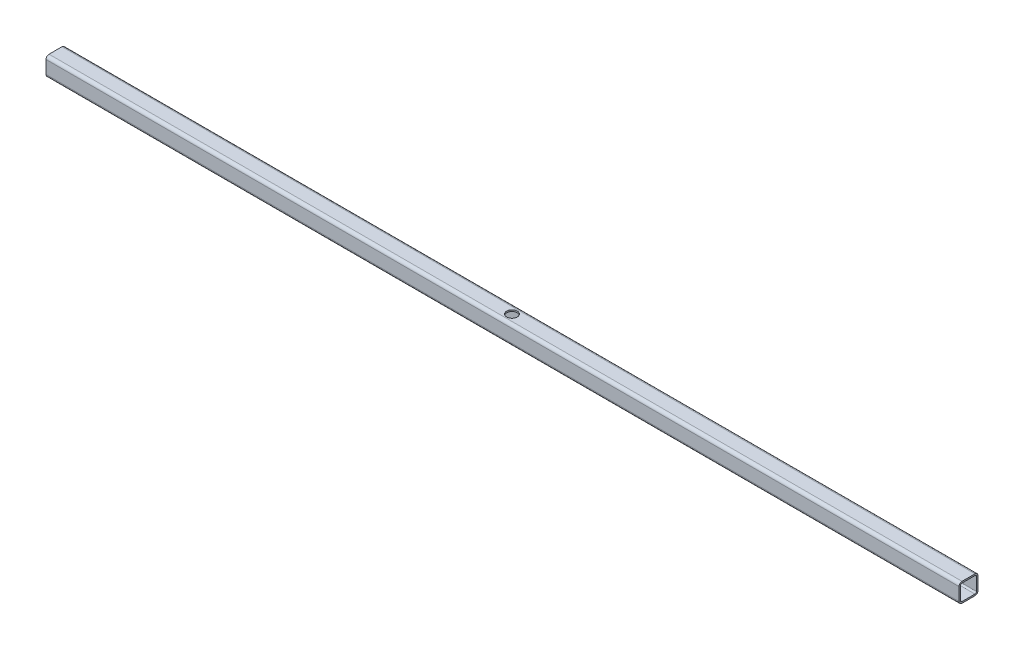
from build123d import *

# Parameters (mm, degrees)
TUBE_SQUARE_40_X_40_X_3_2_4_DEPTH = 1920
SKETCH13_R                        = 11
CUT_EXTRUDE1_DEPTH                = 1921.52076271


with BuildPart() as part:
    # Sketch12 → Tube (square) 40 X 40 X 3.2(4) (new body)
    with BuildSketch(Plane(origin=(0, 0, 0), x_dir=(0, 0, -1), z_dir=(1, 0, 0))):
        with BuildLine():
            Line((-13.6, -20), (13.6, -20))
            ThreePointArc((13.6, -20), (18.1254834, -18.1254834), (20, -13.6))
            Line((20, -13.6), (20, 13.6))
            ThreePointArc((20, 13.6), (18.1254834, 18.1254834), (13.6, 20))
            Line((13.6, 20), (-13.6, 20))
            ThreePointArc((-13.6, 20), (-18.1254834, 18.1254834), (-20, 13.6))
            Line((-20, 13.6), (-20, -13.6))
            ThreePointArc((-20, -13.6), (-18.1254834, -18.1254834), (-13.6, -20))
        make_face()
        with BuildLine():
            Line((-13.6, -16.8), (13.6, -16.8))
            ThreePointArc((13.6, -16.8), (15.8627417, -15.8627417), (16.8, -13.6))
            Line((16.8, -13.6), (16.8, 13.6))
            ThreePointArc((16.8, 13.6), (15.8627417, 15.8627417), (13.6, 16.8))
            Line((13.6, 16.8), (-13.6, 16.8))
            ThreePointArc((-13.6, 16.8), (-15.8627417, 15.8627417), (-16.8, 13.6))
            Line((-16.8, 13.6), (-16.8, -13.6))
            ThreePointArc((-16.8, -13.6), (-15.8627417, -15.8627417), (-13.6, -16.8))
        make_face(mode=Mode.SUBTRACT)
    extrude(amount=TUBE_SQUARE_40_X_40_X_3_2_4_DEPTH)

    # Sketch13 → Cut-Extrude1 (cut, through all)
    with BuildSketch(Plane(origin=(0, 20, 0), x_dir=(1, 0, 0), z_dir=(0, 1, 0))):
        with Locations(Location((960, 0, 0), (0, 0, 270))):
            Circle(SKETCH13_R)
    extrude(amount=-CUT_EXTRUDE1_DEPTH, mode=Mode.SUBTRACT)


solid = part.part
